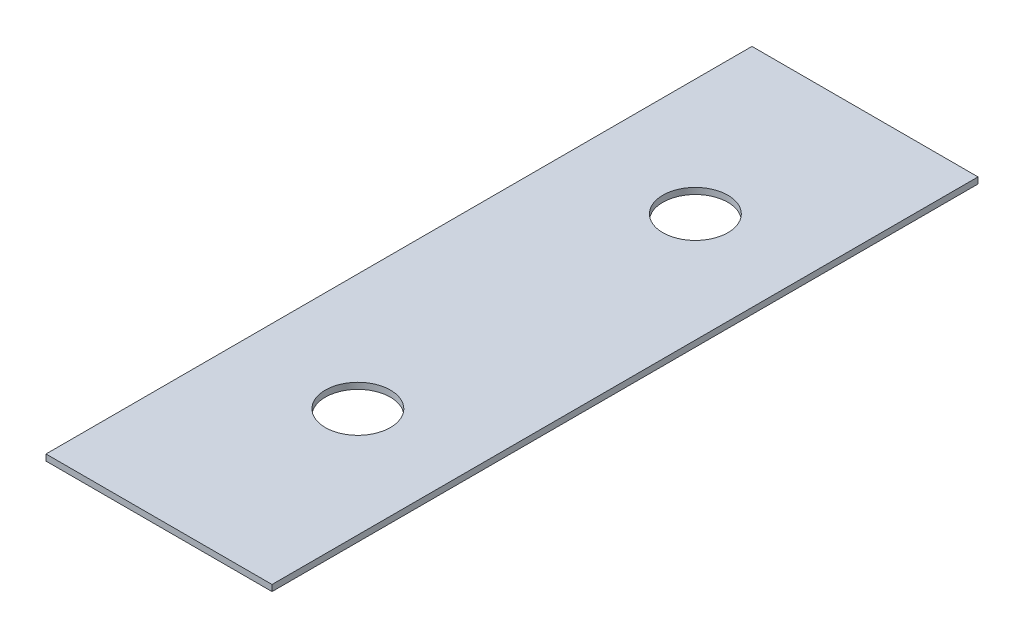
from build123d import *

# Parameters (mm, degrees)
SKETCH1_W           = 73
SKETCH1_H           = 228
BOSS_EXTRUDE1_DEPTH = 2
SKETCH2_R           = 10.5
CUT_EXTRUDE1_DEPTH  = 2


with BuildPart() as part:
    # Sketch1 → Boss-Extrude1 (new body)
    with BuildSketch(Plane(origin=(0, 0, 0), x_dir=(1, 0, 0), z_dir=(0, 1, 0))):
        with Locations((-36.5, -114)):
            Rectangle(SKETCH1_W, SKETCH1_H)
    extrude(amount=BOSS_EXTRUDE1_DEPTH)

    # Sketch2 → Cut-Extrude1 (cut)
    with BuildSketch(Plane(origin=(0, 2, 0), x_dir=(1, 0, 0), z_dir=(0, 1, 0))):
        with Locations(Location((-35.279249756, -56, 0), (0, 0, 270))):
            Circle(SKETCH2_R)
        with Locations(Location((-35.279249756, -165, 0), (0, 0, 270))):
            Circle(SKETCH2_R)
    extrude(amount=-CUT_EXTRUDE1_DEPTH, mode=Mode.SUBTRACT)


solid = part.part
